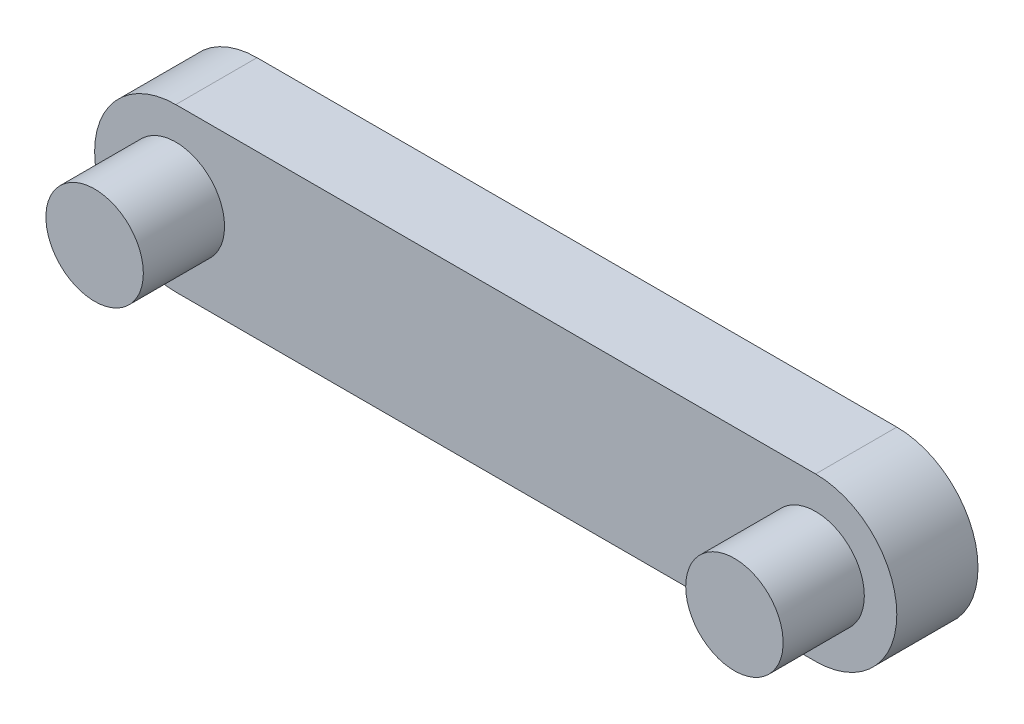
from build123d import *

# Parameters (mm, degrees)
SKETCH1_R           = 3
BOSS_EXTRUDE1_DEPTH = 5
SKETCH2_R           = 3
BOSS_EXTRUDE2_DEPTH = 5
SKETCH3_R           = 3
BOSS_EXTRUDE3_DEPTH = 10


with BuildPart() as part:
    # Sketch1 → Boss-Extrude1 (new body)
    with BuildSketch(Plane.XY):
        with BuildLine():
            Line((19.7, -5), (-19.7, -5))
            ThreePointArc((-19.7, -5), (-24.7, 0), (-19.7, 5))
            Line((-19.7, 5), (19.7, 5))
            ThreePointArc((19.7, 5), (24.7, 0), (19.7, -5))
        make_face()
        with Locations((19.7, 0)):
            Circle(SKETCH1_R, mode=Mode.SUBTRACT)
    extrude(amount=BOSS_EXTRUDE1_DEPTH)

    # Sketch2 → Boss-Extrude2 (add)
    with BuildSketch(Plane.XY.offset(5)):
        with Locations((-19.7, 0)):
            Circle(SKETCH2_R)
    extrude(amount=BOSS_EXTRUDE2_DEPTH)

    # Sketch3 → Boss-Extrude3 (add)
    with BuildSketch(Plane(origin=(0, 0, 0), x_dir=(-1, 0, 0), z_dir=(0, 0, -1))):
        with Locations((-19.7, 0)):
            Circle(SKETCH3_R)
    extrude(amount=-BOSS_EXTRUDE3_DEPTH)


solid = part.part
